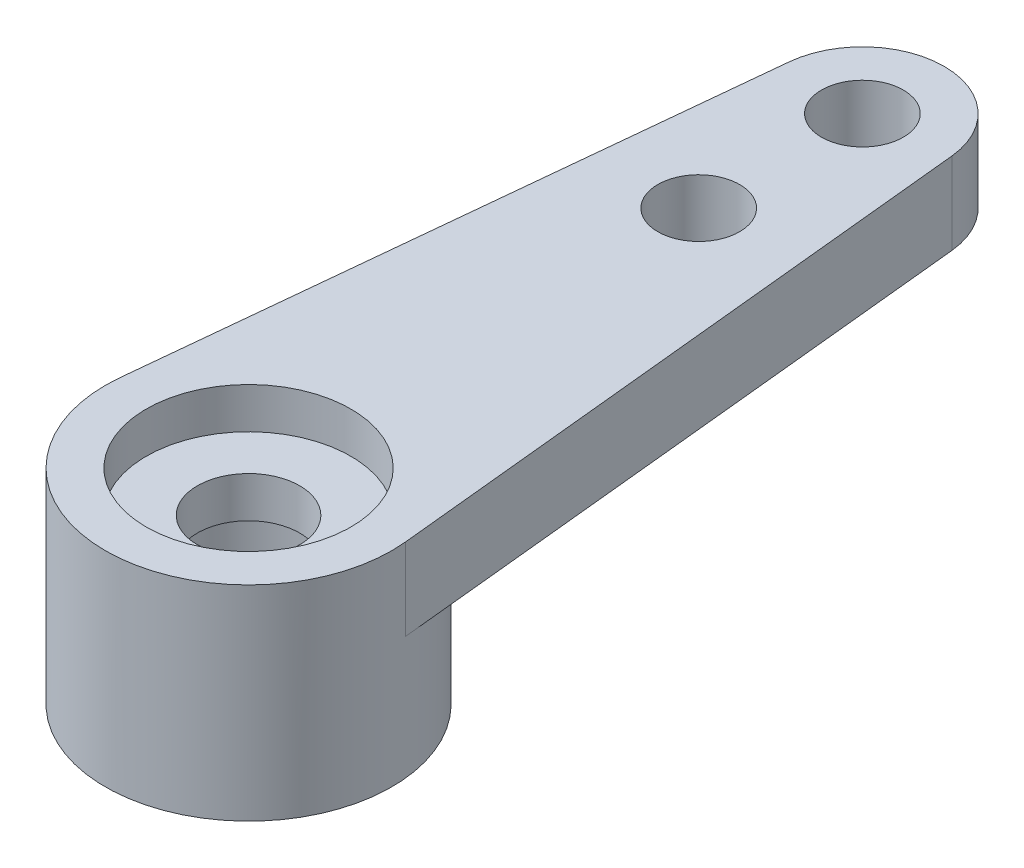
from build123d import *

# Parameters (mm, degrees)
SKETCH_1_R          = 1
SKETCH_1_R_2        = 1.25
EXTRUDE_1_DEPTH     = 2
EXTRUDE_START       = 3
SKETCH_2_R          = 3.5
SKETCH_2_R_2        = 2
EXTRUDE_2_DEPTH     = 3
SKETCH_3_R          = 2.5
CUT_EXTRUDE_1_DEPTH = 1


with BuildPart() as part:
    # 草图1 → 凸台-拉伸1 (new body)
    with BuildSketch(Plane(origin=(0, 0, 0), x_dir=(1, 0, 0), z_dir=(0, 1, 0))):
        with BuildLine():
            Line((-3.48245603, 0.35), (-1.989974874, 15.2))
            ThreePointArc((-1.989974874, 15.2), (0, 17), (1.989974874, 15.2))
            Line((1.989974874, 15.2), (3.48245603, 0.35))
            ThreePointArc((3.48245603, 0.35), (0, -3.5), (-3.48245603, 0.35))
        make_face()
        with Locations(Location((0, 15, 0), (0, 0, 270))):
            Circle(SKETCH_1_R, mode=Mode.SUBTRACT)
        with Locations(Location((0, 11, 0), (0, 0, 270))):
            Circle(SKETCH_1_R, mode=Mode.SUBTRACT)
        with Locations(Location((0, 0, 0), (0, 0, 270))):
            Circle(SKETCH_1_R_2, mode=Mode.SUBTRACT)
    extrude(amount=EXTRUDE_1_DEPTH)

    # 草图2 → 凸台-拉伸2 (add)
    with BuildSketch(Plane.XZ.offset(EXTRUDE_START)):
        with Locations(Location((0, 0, 0), (0, 0, 270))):
            Circle(SKETCH_2_R)
        with Locations(Location((0, 0, 0), (0, 0, 270))):
            Circle(SKETCH_2_R_2, mode=Mode.SUBTRACT)
    extrude(amount=-EXTRUDE_2_DEPTH)

    # 草图3 → 切除-拉伸1 (cut)
    with BuildSketch(Plane(origin=(0, 2, 0), x_dir=(1, 0, 0), z_dir=(0, 1, 0))):
        with Locations(Location((0, 0, 0), (0, 0, 270))):
            Circle(SKETCH_3_R)
    extrude(amount=-CUT_EXTRUDE_1_DEPTH, mode=Mode.SUBTRACT)


solid = part.part
